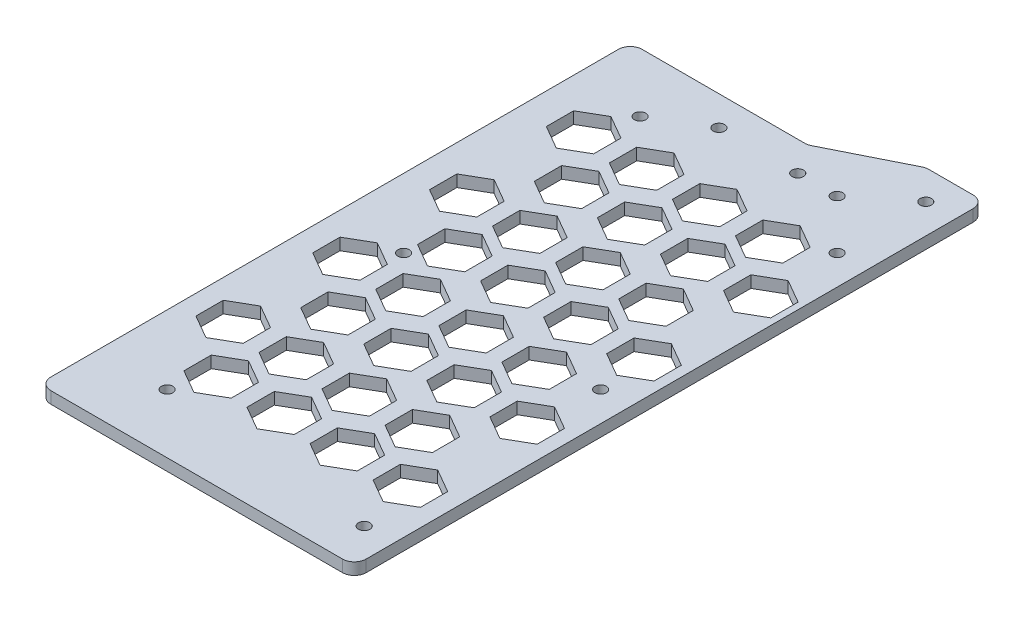
from build123d import *

# Parameters (mm, degrees)
EXTRUDE_1_DEPTH     = 3
SKETCH_4_R          = 1.45
CUT_EXTRUDE_1_DEPTH = 94.9893611
CUT_EXTRUDE_2_DEPTH = 94.9893611
FILLET_1_R          = 3


with BuildPart() as part:
    # 草图1 → 凸台-拉伸1 (new body)
    with BuildSketch(Plane(origin=(0, 0, 0), x_dir=(1, 0, 0), z_dir=(0, 1, 0))):
        Polygon((-40, 75), (5, 75), (25, 85), (40, 85), (40, 75), (40, -75), (-40, -75), align=None)
    extrude(amount=EXTRUDE_1_DEPTH)

    # 草图4 → 切除-拉伸1 (cut, through all)
    with BuildSketch(Plane(origin=(0, 3, 0), x_dir=(1, 0, 0), z_dir=(0, 1, 0))):
        with Locations(Location((32.5, 77.5, 0), (0, 0, 270))):
            Circle(SKETCH_4_R)
        with Locations(Location((32.5, 55, 0), (0, 0, 270))):
            Circle(SKETCH_4_R)
        with Locations(Location((20, 67.5, 0), (0, 0, 270))):
            Circle(SKETCH_4_R)
        with Locations(Location((10, 67.5, 0), (0, 0, 270))):
            Circle(SKETCH_4_R)
        with Locations(Location((32.5, -5, 0), (0, 0, 270))):
            Circle(SKETCH_4_R)
        with Locations(Location((32.5, -65, 0), (0, 0, 270))):
            Circle(SKETCH_4_R)
        with Locations(Location((-22.5, -60, 0), (0, 0, 270))):
            Circle(SKETCH_4_R)
        with Locations(Location((-22.5, 0, 0), (0, 0, 270))):
            Circle(SKETCH_4_R)
        with Locations(Location((-22.5, 60, 0), (0, 0, 270))):
            Circle(SKETCH_4_R)
        with Locations(Location((-10, 67.5, 0), (0, 0, 270))):
            Circle(SKETCH_4_R)
    extrude(amount=-CUT_EXTRUDE_1_DEPTH, mode=Mode.SUBTRACT)

    # 草图5 → 切除-拉伸2 (cut, through all)
    with BuildSketch(Plane(origin=(0, 3, 0), x_dir=(1, 0, 0), z_dir=(0, 1, 0))):
        Polygon((-20.175103039, 52.81500174), (-26.175103039, 56.279103355), (-32.175103039, 52.81500174), (-32.175103039, 45.88679851), (-26.175103039, 42.422696895), (-20.175103039, 45.88679851), align=None)
        Polygon((-4.175103039, 52.81500174), (-10.175103039, 56.279103355), (-16.175103039, 52.81500174), (-16.175103039, 45.88679851), (-10.175103039, 42.422696895), (-4.175103039, 45.88679851), align=None)
        Polygon((-9.661112994, 39.255347571), (-15.661112994, 42.719449186), (-21.661112994, 39.255347571), (-21.661112994, 32.32714434), (-15.661112994, 28.863042725), (-9.661112994, 32.32714434), align=None)
        Polygon((6.338887006, 39.255347571), (0.338887006, 42.719449186), (-5.661112994, 39.255347571), (-5.661112994, 32.32714434), (0.338887006, 28.863042725), (6.338887006, 32.32714434), align=None)
        Polygon((11.824896961, 52.81500174), (5.824896961, 56.279103355), (-0.175103039, 52.81500174), (-0.175103039, 45.88679851), (5.824896961, 42.422696895), (11.824896961, 45.88679851), align=None)
        Polygon((22.338887006, 39.255347571), (16.338887006, 42.719449186), (10.338887006, 39.255347571), (10.338887006, 32.32714434), (16.338887006, 28.863042725), (22.338887006, 32.32714434), align=None)
        Polygon((27.824896961, 52.81500174), (21.824896961, 56.279103355), (15.824896961, 52.81500174), (15.824896961, 45.88679851), (21.824896961, 42.422696895), (27.824896961, 45.88679851), align=None)
        Polygon((38.338887006, 39.255347571), (32.338887006, 42.719449186), (26.338887006, 39.255347571), (26.338887006, 32.32714434), (32.338887006, 28.863042725), (38.338887006, 32.32714434), align=None)
        Polygon((-5.114510011, 24.118507353), (-11.114510011, 27.582608968), (-17.114510011, 24.118507353), (-17.114510011, 17.190304123), (-11.114510011, 13.726202508), (-5.114510011, 17.190304123), align=None)
        Polygon((5.399480035, 10.558853184), (-0.600519965, 14.022954799), (-6.600519965, 10.558853184), (-6.600519965, 3.630649953), (-0.600519965, 0.166548338), (5.399480035, 3.630649953), align=None)
        Polygon((10.885489989, 24.118507353), (4.885489989, 27.582608968), (-1.114510011, 24.118507353), (-1.114510011, 17.190304123), (4.885489989, 13.726202508), (10.885489989, 17.190304123), align=None)
        Polygon((21.399480035, 10.558853184), (15.399480035, 14.022954799), (9.399480035, 10.558853184), (9.399480035, 3.630649953), (15.399480035, 0.166548338), (21.399480035, 3.630649953), align=None)
        Polygon((26.885489989, 24.118507353), (20.885489989, 27.582608968), (14.885489989, 24.118507353), (14.885489989, 17.190304123), (20.885489989, 13.726202508), (26.885489989, 17.190304123), align=None)
        Polygon((37.399480035, 10.558853184), (31.399480035, 14.022954799), (25.399480035, 10.558853184), (25.399480035, 3.630649953), (31.399480035, 0.166548338), (37.399480035, 3.630649953), align=None)
        Polygon((-6.053916982, -4.577987034), (-12.053916982, -1.113885419), (-18.053916982, -4.577987034), (-18.053916982, -11.506190264), (-12.053916982, -14.970291879), (-6.053916982, -11.506190264), align=None)
        Polygon((4.460073063, -18.137641204), (-1.539926937, -14.673539588), (-7.539926937, -18.137641204), (-7.539926937, -25.065844434), (-1.539926937, -28.529946049), (4.460073063, -25.065844434), align=None)
        Polygon((9.946083018, -4.577987034), (3.946083018, -1.113885419), (-2.053916982, -4.577987034), (-2.053916982, -11.506190264), (3.946083018, -14.970291879), (9.946083018, -11.506190264), align=None)
        Polygon((20.460073063, -18.137641204), (14.460073063, -14.673539588), (8.460073063, -18.137641204), (8.460073063, -25.065844434), (14.460073063, -28.529946049), (20.460073063, -25.065844434), align=None)
        Polygon((25.946083018, -4.577987034), (19.946083018, -1.113885419), (13.946083018, -4.577987034), (13.946083018, -11.506190264), (19.946083018, -14.970291879), (25.946083018, -11.506190264), align=None)
        Polygon((36.460073063, -18.137641204), (30.460073063, -14.673539588), (24.460073063, -18.137641204), (24.460073063, -25.065844434), (30.460073063, -28.529946049), (36.460073063, -25.065844434), align=None)
        Polygon((-6.993323954, -33.274481421), (-12.993323954, -29.810379806), (-18.993323954, -33.274481421), (-18.993323954, -40.202684652), (-12.993323954, -43.666786267), (-6.993323954, -40.202684652), align=None)
        Polygon((3.520666091, -46.834135591), (-2.479333909, -43.370033976), (-8.479333909, -46.834135591), (-8.479333909, -53.762338821), (-2.479333909, -57.226440436), (3.520666091, -53.762338821), align=None)
        Polygon((9.006676046, -33.274481421), (3.006676046, -29.810379806), (-2.993323954, -33.274481421), (-2.993323954, -40.202684652), (3.006676046, -43.666786267), (9.006676046, -40.202684652), align=None)
        Polygon((19.520666091, -46.834135591), (13.520666091, -43.370033976), (7.520666091, -46.834135591), (7.520666091, -53.762338821), (13.520666091, -57.226440436), (19.520666091, -53.762338821), align=None)
        Polygon((25.006676046, -33.274481421), (19.006676046, -29.810379806), (13.006676046, -33.274481421), (13.006676046, -40.202684652), (19.006676046, -43.666786267), (25.006676046, -40.202684652), align=None)
        Polygon((35.520666091, -46.834135591), (29.520666091, -43.370033976), (23.520666091, -46.834135591), (23.520666091, -53.762338821), (29.520666091, -57.226440436), (35.520666091, -53.762338821), align=None)
        Polygon((-21.114510011, 24.118507353), (-27.114510011, 27.582608968), (-33.114510011, 24.118507353), (-33.114510011, 17.190304123), (-27.114510011, 13.726202508), (-21.114510011, 17.190304123), align=None)
        Polygon((-10.600519965, 10.558853184), (-16.600519965, 14.022954799), (-22.600519965, 10.558853184), (-22.600519965, 3.630649953), (-16.600519965, 0.166548338), (-10.600519965, 3.630649953), align=None)
        Polygon((-22.053916982, -4.577987034), (-28.053916982, -1.113885419), (-34.053916982, -4.577987034), (-34.053916982, -11.506190264), (-28.053916982, -14.970291879), (-22.053916982, -11.506190264), align=None)
        Polygon((-11.539926937, -18.137641204), (-17.539926937, -14.673539588), (-23.539926937, -18.137641204), (-23.539926937, -25.065844434), (-17.539926937, -28.529946049), (-11.539926937, -25.065844434), align=None)
        Polygon((-22.993323954, -33.274481421), (-28.993323954, -29.810379806), (-34.993323954, -33.274481421), (-34.993323954, -40.202684652), (-28.993323954, -43.666786267), (-22.993323954, -40.202684652), align=None)
        Polygon((-12.479333909, -46.834135591), (-18.479333909, -43.370033976), (-24.479333909, -46.834135591), (-24.479333909, -53.762338821), (-18.479333909, -57.226440436), (-12.479333909, -53.762338821), align=None)
    extrude(amount=-CUT_EXTRUDE_2_DEPTH, mode=Mode.SUBTRACT)

    # 圆角1
    fillet_1_edges = [part.edges().sort_by_distance(p)[0] for p in [
        (40, 1.5, 75),
        (-40, 1.5, 75),
        (-40, 1.5, -75),
        (5, 1.5, -75),
        (25, 1.5, -85),
        (40, 1.5, -85),
    ]]
    fillet(fillet_1_edges, radius=FILLET_1_R)


solid = part.part
